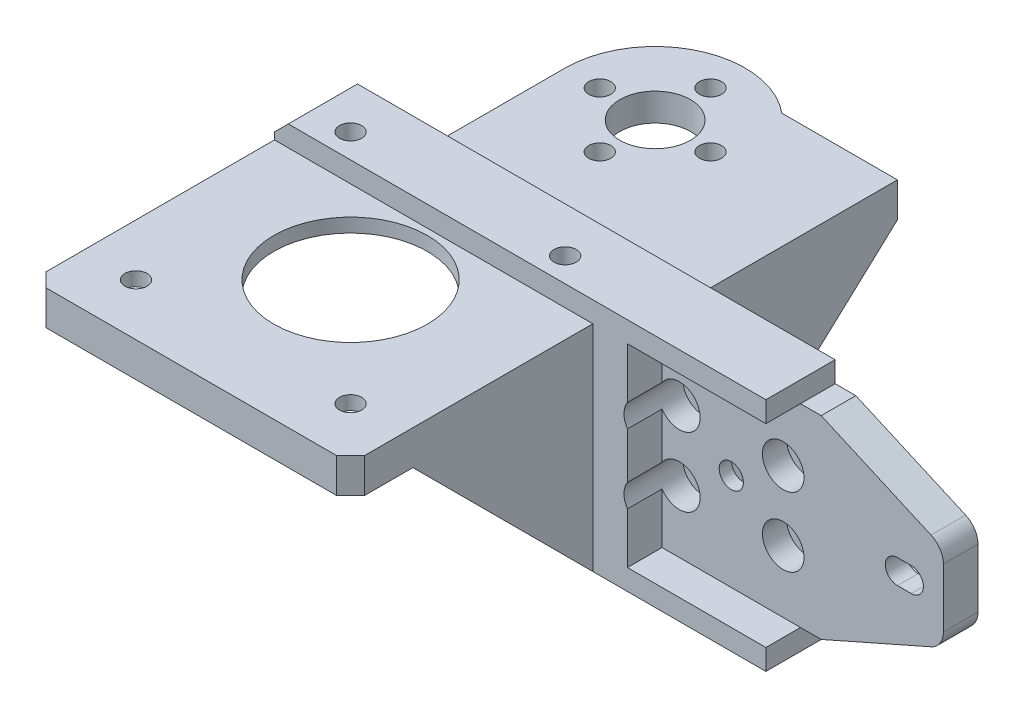
from build123d import *

# Parameters (mm, degrees)
SKETCH_1_W                = 20
SKETCH_1_H                = 34
EXTRUDE_1_DEPTH           = 5
SKETCH_2_W                = 20
SKETCH_2_H                = 3
EXTRUDE_2_DEPTH           = 5
EXTRUDE_3_DEPTH           = 5
FILLET_1_R                = 3
CUT_EXTRUDE_1_DEPTH       = 2
SKETCH_7_R                = 1.6
CUT_EXTRUDE_2_DEPTH       = 41.087864079
SKETCH_8_R                = 1.75
CUT_EXTRUDE_3_DEPTH       = 41.087864079
CUT_EXTRUDE_5_DEPTH       = 3.2
SKETCH_14_W               = 10
SKETCH_14_H               = 3
EXTRUDE_26_DEPTH          = 51
SKETCH_11_W               = 51
SKETCH_11_H               = 87.152977717
SKETCH_11_R               = 11.1
SKETCH_11_R_2             = 1.6
EXTRUDE_27_DEPTH          = 5
CUT_EXTRUDE_7_DEPTH       = 3
SKETCH_16_R               = 1.6
CUT_EXTRUDE_8_DEPTH       = 89.921313531
EXTRUDE_28_DEPTH          = 6.7
SKETCH_18_W               = 40
SKETCH_18_H               = 5
CUT_EXTRUDE_9_DEPTH       = 5
CHAMFER_1_SIZE            = 2
SKETCH_19_W               = 1.7
SKETCH_19_H               = 23
EXTRUDE_31_DEPTH          = 5
SKETCH_20_W               = 5
SKETCH_20_H               = 28
EXTRUDE_33_DEPTH          = 5
EXTRUDE_34_DEPTH          = 1.7
SKETCH_24_R               = 11.1
CUT_EXTRUDE_10_DEPTH      = 1
CUT_EXTRUDE_12_DEPTH      = 88.98863563
SKETCH_26_R               = 5.1
CUT_EXTRUDE_13_DEPTH      = 89.2892972
CHAMFER_2_SIZE            = 2
EXTRUDE_35_DEPTH          = 5.7
EXTRUDE_36_DEPTH          = 2
EXTRUDE_37_DEPTH          = 26
CUT_EXTRUDE_14_DEPTH      = 91.329895384
SKETCH_32_R               = 1.6
CUT_EXTRUDE_15_DEPTH      = 89.2892972
CUT_EXTRUDE_16_DEPTH      = 10
CUT_EXTRUDE_16_DEPTH_BACK = 3.5
SKETCH_33_R               = 3


with BuildPart() as part:
    # 草图1 → 凸台-拉伸1 (new body)
    with BuildSketch(Plane.XY):
        with Locations((-10, 17)):
            Rectangle(SKETCH_1_W, SKETCH_1_H)
    extrude(amount=EXTRUDE_1_DEPTH)

    # 草图2 → 凸台-拉伸2 (add)
    with BuildSketch(Plane.XY.offset(5)):
        with Locations((-10, 32.5)):
            Rectangle(SKETCH_2_W, SKETCH_2_H)
        with Locations((-10, 1.5)):
            Rectangle(SKETCH_2_W, SKETCH_2_H)
    extrude(amount=EXTRUDE_2_DEPTH)

    # 草图4 → 凸台-拉伸3 (add)
    with BuildSketch(Plane(origin=(0, 0, 0), x_dir=(-1, 0, 0), z_dir=(0, 0, -1))):
        Polygon((0, 3), (0, 31), (-2.991740991, 31), (-20.640660029, 23.203556304), (-20.640660029, 10.796443696), (-2.991740991, 3), align=None)
        with BuildLine():
            ThreePointArc((-16, 15.25), (-17.75, 17), (-16, 18.75))
            Line((-16, 18.75), (-14, 18.75))
            ThreePointArc((-14, 18.75), (-12.25, 17), (-14, 15.25))
            Line((-14, 15.25), (-16, 15.25))
        make_face(mode=Mode.SUBTRACT)
    extrude(amount=-EXTRUDE_3_DEPTH)

    # 圆角1
    fillet_1_edges = [part.edges().sort_by_distance(p)[0] for p in [
        (20.640660029, 10.796443696, 2.5),
        (20.640660029, 23.203556304, 2.5),
    ]]
    fillet(fillet_1_edges, radius=FILLET_1_R)

    # 草图5 → 切除-拉伸1 (cut)
    with BuildSketch(Plane(origin=(0, 0, 0), x_dir=(-1, 0, 0), z_dir=(0, 0, -1))):
        with BuildLine():
            Line((-16, 20.25), (-13.505814151, 20.212208017))
            ThreePointArc((-13.505814151, 20.212208017), (-10.759461769, 16.75218561), (-14, 13.75))
            Line((-14, 13.75), (-16, 13.75))
            ThreePointArc((-16, 13.75), (-19.25, 17), (-16, 20.25))
        make_face()
    extrude(amount=-CUT_EXTRUDE_1_DEPTH, mode=Mode.SUBTRACT)

    # 草图7 → 切除-拉伸2 (cut, through all)
    with BuildSketch(Plane.XY.offset(5)):
        with Locations((-17.5, 22)):
            Circle(SKETCH_7_R)
        with Locations((-2.5, 22)):
            Circle(SKETCH_7_R)
        with Locations((-2.5, 12)):
            Circle(SKETCH_7_R)
        with Locations((-17.5, 12)):
            Circle(SKETCH_7_R)
    extrude(amount=-CUT_EXTRUDE_2_DEPTH, mode=Mode.SUBTRACT)

    # 草图8 → 切除-拉伸3 (cut, through all)
    with BuildSketch(Plane.XY.offset(5)):
        with Locations((-10, 17)):
            Circle(SKETCH_8_R)
    extrude(amount=-CUT_EXTRUDE_3_DEPTH, mode=Mode.SUBTRACT)

    # 草图9 → 切除-拉伸5 (cut)
    with BuildSketch(Plane(origin=(0, 0, 0), x_dir=(-1, 0, 0), z_dir=(0, 0, -1))):
        Polygon((11.668772273, 13.964345359), (13.463340173, 16.927371861), (11.7945679, 19.963026502), (8.331227727, 20.035654641), (6.536659827, 17.072628139), (8.2054321, 14.036973498), align=None)
    extrude(amount=-CUT_EXTRUDE_5_DEPTH, mode=Mode.SUBTRACT)

    # 草图14 → 凸台-拉伸26 (add)
    with BuildSketch(Plane.ZY.offset(20)):
        with Locations((5, 32.5)):
            Rectangle(SKETCH_14_W, SKETCH_14_H)
    extrude(amount=EXTRUDE_26_DEPTH)

    # 草图11 → 凸台-拉伸27 (add)
    with BuildSketch(Plane.XZ.offset(-31)):
        with Locations((-45.5, 1.423511141)):
            Rectangle(SKETCH_11_W, SKETCH_11_H)
        with Locations(Location((-48, 22, 0), (0, 0, 270))):
            Circle(SKETCH_11_R, mode=Mode.SUBTRACT)
        with Locations(Location((-32.5, 37.5, 0), (0, 0, 270))):
            Circle(SKETCH_11_R_2, mode=Mode.SUBTRACT)
        with Locations(Location((-32.5, 6.5, 0), (0, 0, 90))):
            Circle(SKETCH_11_R_2, mode=Mode.SUBTRACT)
        with Locations(Location((-63.5, 6.5, 0), (0, 0, 270))):
            Circle(SKETCH_11_R_2, mode=Mode.SUBTRACT)
        with Locations(Location((-63.5, 37.5, 0), (0, 0, 90))):
            Circle(SKETCH_11_R_2, mode=Mode.SUBTRACT)
    extrude(amount=EXTRUDE_27_DEPTH)

    # 草图15 → 切除-拉伸7 (cut)
    with BuildSketch(Plane.XZ.offset(-26)):
        Polygon((-67.3, 43.3), (-28.7, 43.3), (-26.7, 41.3), (-26.7, 2.7), (-28.7, 0.7), (-67.3, 0.7), (-69.3, 2.7), (-69.3, 41.3), align=None)
    extrude(amount=-CUT_EXTRUDE_7_DEPTH, mode=Mode.SUBTRACT)

    # 草图16 → 切除-拉伸8 (cut, through all)
    with BuildSketch(Plane.XZ.offset(-29)):
        with Locations(Location((-63.5, 6.5, 0), (0, 0, 90))):
            Circle(SKETCH_16_R)
        with Locations(Location((-32.5, 6.5, 0), (0, 0, 90))):
            Circle(SKETCH_16_R)
    extrude(amount=-CUT_EXTRUDE_8_DEPTH, mode=Mode.SUBTRACT)

    # 草图17 → 凸台-拉伸28 (add)
    with BuildSketch(Plane.ZY.offset(20)):
        Polygon((0, 26), (5, 26), (5, 3), (10, 3), (10, 0), (0, 0), align=None)
    extrude(amount=EXTRUDE_28_DEPTH)

    # 草图18 → 切除-拉伸9 (cut)
    with BuildSketch(Plane(origin=(-20, 0, 0), x_dir=(0, 0, -1), z_dir=(1, 0, 0))):
        with Locations((-25, 28.5)):
            Rectangle(SKETCH_18_W, SKETCH_18_H)
    extrude(amount=-CUT_EXTRUDE_9_DEPTH, mode=Mode.SUBTRACT)

    # 倒角1
    chamfer_1_edges = [part.edges().sort_by_distance(p)[0] for p in [
        (-71, 34, 5),
        (-71, 28.5, 45),
        (-25, 28.5, 45),
    ]]
    chamfer(chamfer_1_edges, length=CHAMFER_1_SIZE)

    # 草图19 → 凸台-拉伸31 (add)
    with BuildSketch(Plane.XY.offset(5)):
        with Locations((-25.85, 14.5)):
            Rectangle(SKETCH_19_W, SKETCH_19_H)
    extrude(amount=EXTRUDE_31_DEPTH)

    # 草图20 → 凸台-拉伸33 (add)
    with BuildSketch(Plane(origin=(-25, 0, 0), x_dir=(0, 0, -1), z_dir=(1, 0, 0))):
        with Locations((-7.5, 17)):
            Rectangle(SKETCH_20_W, SKETCH_20_H)
    extrude(amount=EXTRUDE_33_DEPTH)

    # 草图23 → 凸台-拉伸34 (add)
    with BuildSketch(Plane(origin=(-25, 0, 0), x_dir=(0, 0, -1), z_dir=(1, 0, 0))):
        Polygon((-10, 0), (-10, 26), (-36, 26), align=None)
    extrude(amount=-EXTRUDE_34_DEPTH)

    # 草图24 → 切除-拉伸10 (cut)
    with BuildSketch(Plane.XZ.offset(-26)):
        with Locations(Location((-46, -20, 0), (0, 0, 270))):
            Circle(SKETCH_24_R)
    extrude(amount=-CUT_EXTRUDE_10_DEPTH, mode=Mode.SUBTRACT)

    # 草图25 → 切除-拉伸12 (cut, through all)
    with BuildSketch(Plane.XZ.offset(-26)):
        with BuildLine():
            Line((-78.519072423, -1.3), (-59, -1.3))
            Line((-59, -1.3), (-59, -20))
            ThreePointArc((-59, -20), (-51.523309234, -31.768307232), (-37.693376137, -30))
            Line((-37.693376137, -30), (-21, -30))
            Line((-21, -30), (-21, 0))
            Line((-21, 0), (-16.887627511, 0))
            Line((-16.887627511, 0), (-16.887627511, -53.680594447))
            Line((-16.887627511, -53.680594447), (-78.519072423, -54.78523931))
            Line((-78.519072423, -54.78523931), (-78.519072423, -1.3))
        make_face()
    extrude(amount=-CUT_EXTRUDE_12_DEPTH, mode=Mode.SUBTRACT)

    # 草图26 → 切除-拉伸13 (cut, through all)
    with BuildSketch(Plane.XZ.offset(-27)):
        with Locations(Location((-46, -20, 0), (0, 0, 270))):
            Circle(SKETCH_26_R)
    extrude(amount=-CUT_EXTRUDE_13_DEPTH, mode=Mode.SUBTRACT)

    # 倒角2
    chamfer_2_edges = [part.edges().sort_by_distance(p)[0] for p in [
        (-71, 28.5, -1.3),
    ]]
    chamfer(chamfer_2_edges, length=CHAMFER_2_SIZE)

    # 草图27 → 凸台-拉伸35 (add)
    with BuildSketch(Plane.ZY.offset(26.7)):
        Polygon((0, 0), (0, 26), (-30, 26), (-1.72204929, 0), align=None)
    extrude(amount=-EXTRUDE_35_DEPTH)

    # 草图28 → 凸台-拉伸36 (add)
    with BuildSketch(Plane.XY.offset(0.7)):
        Polygon((-55.07905283, 26), (-26.7, 26), (-26.7, 0), align=None)
    extrude(amount=-EXTRUDE_36_DEPTH)

    # 草图29 → 凸台-拉伸37 (add)
    with BuildSketch(Plane.XZ.offset(-26)):
        Polygon((-26.7, 2.7), (-28.7, 0.7), (-26.7, 0.7), align=None)
    extrude(amount=EXTRUDE_37_DEPTH)

    # 草图30 → 切除-拉伸14 (cut, through all)
    with BuildSketch(Plane(origin=(0, 0, 0.7), x_dir=(-1, 0, 0), z_dir=(0, 0, -1))):
        Polygon((28.7, 0), (26.7, 0), (28.7, 1.832337404), align=None)
    extrude(amount=-CUT_EXTRUDE_14_DEPTH, mode=Mode.SUBTRACT)

    # 草图32 → 切除-拉伸15 (cut, through all)
    with BuildSketch(Plane.XZ.offset(-27)):
        with Locations(Location((-46, -12, 0), (0, 0, 270))):
            Circle(SKETCH_32_R)
        with Locations(Location((-54, -20, 0), (0, 0, 270))):
            Circle(SKETCH_32_R)
        with Locations(Location((-38, -20, 0), (0, 0, 270))):
            Circle(SKETCH_32_R)
        with Locations(Location((-46, -28, 0), (0, 0, 270))):
            Circle(SKETCH_32_R)
    extrude(amount=-CUT_EXTRUDE_15_DEPTH, mode=Mode.SUBTRACT)

    # 草图33 → 切除-拉伸16 (cut, two sides: drawn at the far end of the back side and taken through both)
    with BuildSketch(Plane.XY.offset(5).offset(-CUT_EXTRUDE_16_DEPTH_BACK)):
        with Locations((-2.5, 12)):
            Circle(SKETCH_33_R)
        with Locations(Location((-17.5, 12, 0), (0, 0, 213.557309762))):
            Circle(SKETCH_33_R)
        with Locations((-2.5, 22)):
            Circle(SKETCH_33_R)
        with Locations(Location((-17.5, 22, 0), (0, 0, 146.442690238))):
            Circle(SKETCH_33_R)
    extrude(amount=CUT_EXTRUDE_16_DEPTH + CUT_EXTRUDE_16_DEPTH_BACK, mode=Mode.SUBTRACT)


solid = part.part
